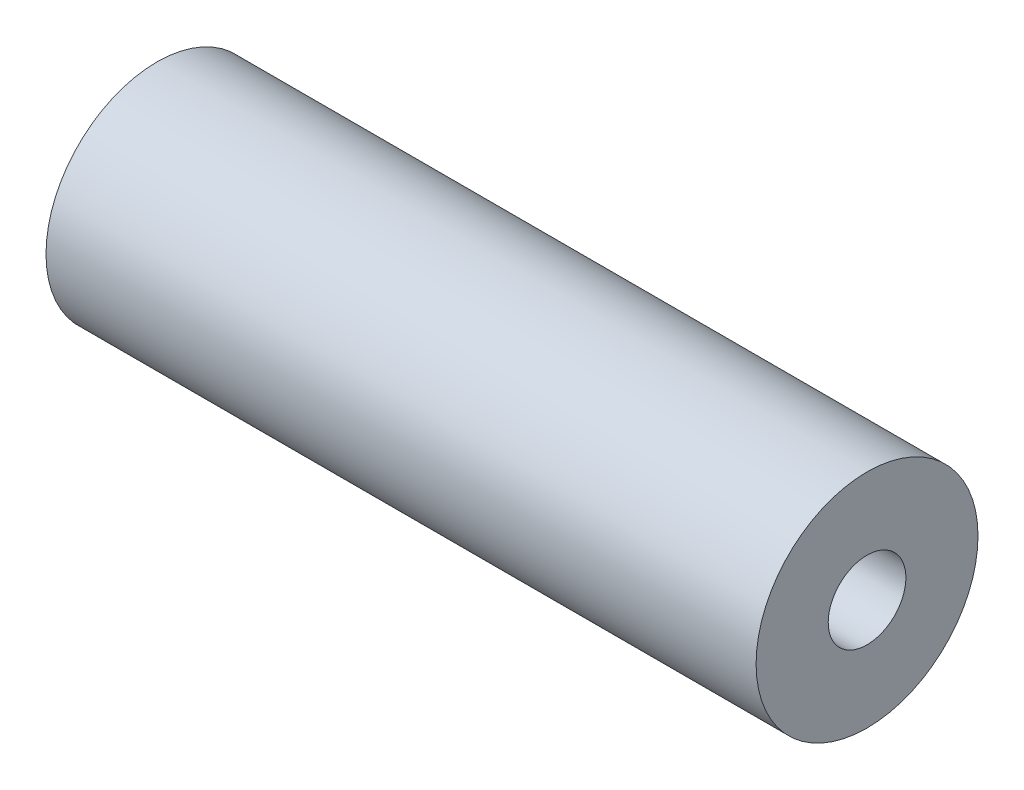
from build123d import *

# Parameters (mm, degrees)
SCHIZZO1_W = 32
SCHIZZO1_H = 3.25


with BuildPart() as part:
    # Schizzo1 → Rivoluzione1 (revolve)
    with BuildSketch(Plane.XY, mode=Mode.PRIVATE) as rivoluzione1_sk:
        with Locations((16, 3.375)):
            Rectangle(SCHIZZO1_W, SCHIZZO1_H)
    revolve(rivoluzione1_sk.sketch.rotate(Axis((0, 0, 0), (1, 0, 0)), 90), axis=Axis((0, 0, 0), (1, 0, 0)))


solid = part.part
